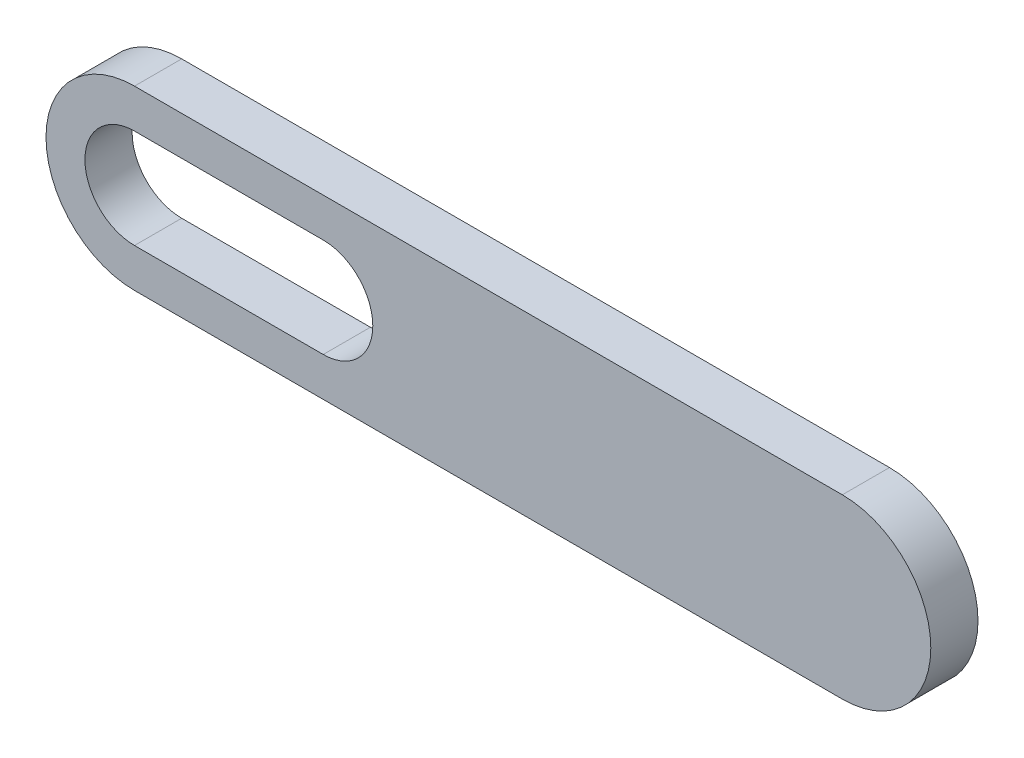
from build123d import *

# Parameters (mm, degrees)
EXTRUDE1_DEPTH = 20


with BuildPart() as part:
    # Sketch1 → Extrude1 (new body)
    with BuildSketch(Plane.XY):
        with BuildLine():
            Line((-40, 37.5), (260, 37.5))
            ThreePointArc((260, 37.5), (297.5, 0), (260, -37.5))
            Line((260, -37.5), (-40, -37.5))
            ThreePointArc((-40, -37.5), (-77.5, 0), (-40, 37.5))
        make_face()
        with BuildLine():
            Line((-40, 21), (40, 21))
            ThreePointArc((40, 21), (61, 0), (40, -21))
            Line((40, -21), (-40, -21))
            ThreePointArc((-40, -21), (-61, 0), (-40, 21))
        make_face(mode=Mode.SUBTRACT)
    extrude(amount=EXTRUDE1_DEPTH)


solid = part.part
